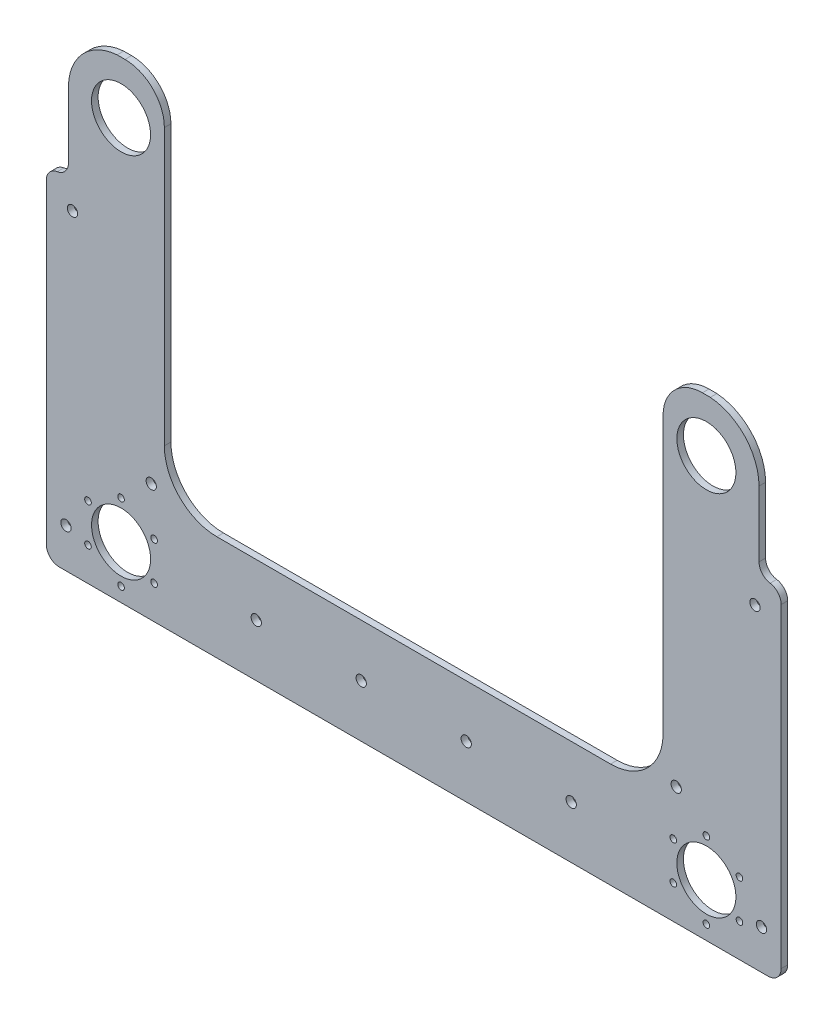
from build123d import *

# Parameters (mm, degrees)
SKETCH1_R           = 14.2875
SKETCH1_R_2         = 1.6002
SKETCH1_R_3         = 2.4892
BOSS_EXTRUDE3_DEPTH = 3.175
SKETCH2_W           = 355.6
SKETCH2_H           = 19.05
CUT_EXTRUDE1_DEPTH  = 290.621961572
FILLET1_R           = 19.05
CUT_EXTRUDE2_DEPTH  = 290.621961572
FILLET2_R           = 6.35


with BuildPart() as part:
    # Sketch1 → Boss-Extrude3 (new body)
    with BuildSketch(Plane.XY):
        with BuildLine():
            Line((120.65, -152.4), (120.65, -6.35))
            Line((120.65, -6.35), (120.65, 6.35))
            ThreePointArc((120.65, 6.35), (124.369743879, 15.330256121), (133.35, 19.05))
            Line((133.35, 19.05), (165.1, 19.05))
            ThreePointArc((165.1, 19.05), (174.080256121, 15.330256121), (177.8, 6.35))
            Line((177.8, 6.35), (177.8, -6.35))
            Line((177.8, -6.35), (177.8, -222.25))
            ThreePointArc((177.8, -222.25), (175.940128061, -226.740128061), (171.45, -228.6))
            Line((171.45, -228.6), (12.7, -228.6))
            Line((12.7, -228.6), (-12.7, -228.6))
            Line((-12.7, -228.6), (-171.45, -228.6))
            ThreePointArc((-171.45, -228.6), (-175.940128061, -226.740128061), (-177.8, -222.25))
            Line((-177.8, -222.25), (-177.8, -6.35))
            Line((-177.8, -6.35), (-177.8, 6.35))
            ThreePointArc((-177.8, 6.35), (-174.080256121, 15.330256121), (-165.1, 19.05))
            Line((-165.1, 19.05), (-133.35, 19.05))
            ThreePointArc((-133.35, 19.05), (-124.369743879, 15.330256121), (-120.65, 6.35))
            Line((-120.65, 6.35), (-120.65, -6.35))
            Line((-120.65, -6.35), (-120.65, -152.4))
            ThreePointArc((-120.65, -152.4), (-113.210512242, -170.360512242), (-95.25, -177.8))
            Line((-95.25, -177.8), (-12.7, -177.8))
            Line((-12.7, -177.8), (12.7, -177.8))
            Line((12.7, -177.8), (95.25, -177.8))
            ThreePointArc((95.25, -177.8), (113.210512242, -170.360512242), (120.65, -152.4))
        make_face()
        with Locations((141.605, -25.4)):
            Circle(SKETCH1_R, mode=Mode.SUBTRACT)
        with Locations(Location((-141.605, -25.4, 0), (0, 0, 180))):
            Circle(SKETCH1_R, mode=Mode.SUBTRACT)
        with Locations((-141.605, -203.2)):
            Circle(SKETCH1_R, mode=Mode.SUBTRACT)
        with Locations((-141.605, -184.724802)):
            Circle(SKETCH1_R_2, mode=Mode.SUBTRACT)
        with Locations((-125.604004596, -193.962981004)):
            Circle(SKETCH1_R_2, mode=Mode.SUBTRACT)
        with Locations((-125.604004596, -212.439339011)):
            Circle(SKETCH1_R_2, mode=Mode.SUBTRACT)
        with Locations((-141.605, -221.677518015)):
            Circle(SKETCH1_R_2, mode=Mode.SUBTRACT)
        with Locations((-157.605995404, -212.439339011)):
            Circle(SKETCH1_R_2, mode=Mode.SUBTRACT)
        with Locations((-157.605995404, -193.962981004)):
            Circle(SKETCH1_R_2, mode=Mode.SUBTRACT)
        with Locations(Location((157.605995404, -212.439339011, 0), (0, 0, 180))):
            Circle(SKETCH1_R_2, mode=Mode.SUBTRACT)
        with Locations(Location((157.605995404, -193.962981004, 0), (0, 0, 180))):
            Circle(SKETCH1_R_2, mode=Mode.SUBTRACT)
        with Locations(Location((141.605, -184.724802, 0), (0, 0, 180))):
            Circle(SKETCH1_R_2, mode=Mode.SUBTRACT)
        with Locations(Location((125.604004596, -193.962981004, 0), (0, 0, 180))):
            Circle(SKETCH1_R_2, mode=Mode.SUBTRACT)
        with Locations(Location((125.604004596, -212.439339011, 0), (0, 0, 180))):
            Circle(SKETCH1_R_2, mode=Mode.SUBTRACT)
        with Locations(Location((141.605, -221.677518015, 0), (0, 0, 180))):
            Circle(SKETCH1_R_2, mode=Mode.SUBTRACT)
        with Locations(Location((141.605, -203.2, 0), (0, 0, 180))):
            Circle(SKETCH1_R, mode=Mode.SUBTRACT)
        with Locations((-76.2, -203.2)):
            Circle(SKETCH1_R_3, mode=Mode.SUBTRACT)
        with Locations(Location((76.2, -203.2, 0), (0, 0, 180))):
            Circle(SKETCH1_R_3, mode=Mode.SUBTRACT)
        with Locations((-25.4, -203.2)):
            Circle(SKETCH1_R_3, mode=Mode.SUBTRACT)
        with Locations((-127, -171.45)):
            Circle(SKETCH1_R_3, mode=Mode.SUBTRACT)
        with Locations((-149.225, 6.35)):
            Circle(SKETCH1_R_3, mode=Mode.SUBTRACT)
        with Locations(Location((127, -171.45, 0), (0, 0, 180))):
            Circle(SKETCH1_R_3, mode=Mode.SUBTRACT)
        with Locations(Location((149.225, 6.35, 0), (0, 0, 180))):
            Circle(SKETCH1_R_3, mode=Mode.SUBTRACT)
        with Locations((-168.275, -209.55)):
            Circle(SKETCH1_R_3, mode=Mode.SUBTRACT)
        with Locations(Location((168.275, -209.55, 0), (0, 0, 180))):
            Circle(SKETCH1_R_3, mode=Mode.SUBTRACT)
        with Locations((-165.1, -76.2)):
            Circle(SKETCH1_R_3, mode=Mode.SUBTRACT)
        with Locations(Location((165.1, -76.2, 0), (0, 0, 180))):
            Circle(SKETCH1_R_3, mode=Mode.SUBTRACT)
        with Locations(Location((25.4, -203.2, 0), (0, 0, 180))):
            Circle(SKETCH1_R_3, mode=Mode.SUBTRACT)
    extrude(amount=BOSS_EXTRUDE3_DEPTH)

    # Sketch2 → Cut-Extrude1 (cut, through all)
    with BuildSketch(Plane.XY.offset(3.175)):
        with Locations((0, 9.525)):
            Rectangle(SKETCH2_W, SKETCH2_H)
    extrude(amount=-CUT_EXTRUDE1_DEPTH, mode=Mode.SUBTRACT)

    # Fillet1
    fillet1_edges = [part.edges().sort_by_distance(p)[0] for p in [
        (-177.8, 0, 1.5875),
        (120.65, 0, 1.5875),
        (177.8, 0, 1.5875),
        (-120.65, 0, 1.5875),
    ]]
    fillet(fillet1_edges, radius=FILLET1_R)

    # Sketch3 → Cut-Extrude2 (cut, through all)
    with BuildSketch(Plane.XY.offset(3.175)):
        with BuildLine():
            ThreePointArc((-177.8, -19.05), (-172.220384182, -5.579615818), (-158.75, 0))
            Line((-158.75, 0), (-177.8, 0))
            Line((-177.8, 0), (-177.8, -19.05))
        make_face()
        with BuildLine():
            Line((-167.076337323, -57.15), (-167.076337323, -25.4))
            ThreePointArc((-167.076337323, -25.4), (-160.277331437, -8.075651132), (-143.51, 0))
            Line((-143.51, 0), (-158.75, 0))
            ThreePointArc((-158.75, 0), (-172.220384182, -5.579615818), (-177.8, -19.05))
            Line((-177.8, -19.05), (-177.8, -63.5))
            Line((-177.8, -63.5), (-173.426337323, -63.5))
            ThreePointArc((-173.426337323, -63.5), (-168.936209262, -61.640128061), (-167.076337323, -57.15))
        make_face()
    cut_extrude2 = extrude(amount=-CUT_EXTRUDE2_DEPTH, mode=Mode.SUBTRACT)

    # Mirror1: Cut-Extrude2 across plane
    add(cut_extrude2.mirror(Plane(origin=(0, 0, 0), x_dir=(0, 0, 1), z_dir=(1, 0, 0))), mode=Mode.SUBTRACT)

    # Fillet2
    fillet2_edges = [part.edges().sort_by_distance(p)[0] for p in [
        (177.8, -63.5, 1.5875),
        (-177.8, -63.5, 1.5875),
    ]]
    fillet(fillet2_edges, radius=FILLET2_R)


solid = part.part
